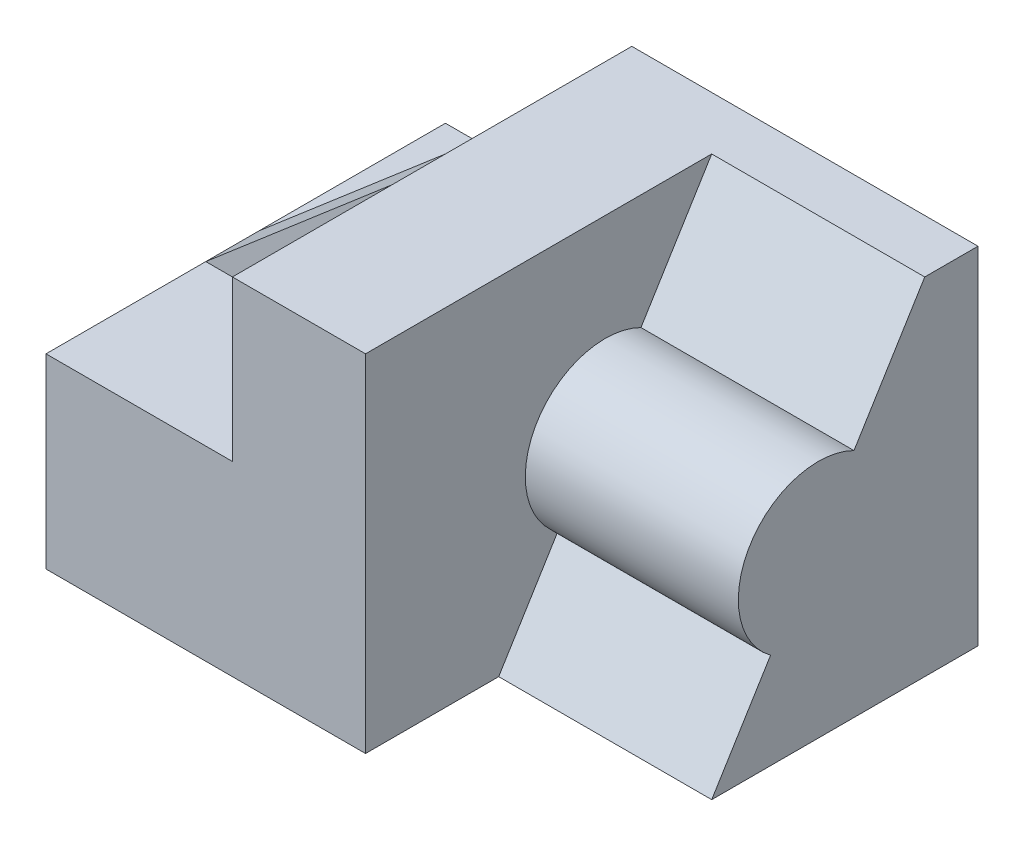
from build123d import *

# Parameters (mm, degrees)
RESSALTO_EXTRUS_O1_DEPTH = 75
RESSALTO_EXTRUS_O2_DEPTH = 40
ESBO_O4_W                = 10
ESBO_O4_H                = 30
RESSALTO_EXTRUS_O3_DEPTH = 35
CORTE_EXTRUS_O1_REACH    = 101.247


with BuildPart() as part:
    # Esboço2 → Ressalto-extrusão1 (new body)
    with BuildSketch(Plane.XY):
        Polygon((-60, 35), (-60, 0), (0, 0), (0, 65), (-25, 65), (-25, 35), align=None)
    extrude(amount=-RESSALTO_EXTRUS_O1_DEPTH)

    # Esboço3 → Ressalto-extrusão2 (add)
    with BuildSketch(Plane(origin=(0, 0, 0), x_dir=(0, 0, -1), z_dir=(1, 0, 0))):
        with BuildLine():
            Line((65, 65), (51.71553286, 43.412740898))
            ThreePointArc((51.71553286, 43.412740898), (32.225125249, 37.861461385), (36.052707483, 17.96064966))
            Line((36.052707483, 17.96064966), (25, 0))
            Line((25, 0), (75, 0))
            Line((75, 0), (75, 65))
            Line((75, 65), (65, 65))
        make_face()
    extrude(amount=RESSALTO_EXTRUS_O2_DEPTH)

    # Esboço4 → Ressalto-extrusão3 (add)
    with BuildSketch(Plane.ZY.offset(25)):
        with Locations((-35, 50)):
            Rectangle(ESBO_O4_W, ESBO_O4_H)
    extrude(amount=RESSALTO_EXTRUS_O3_DEPTH)

    # Esboço6 → Corte-extrusão1 (cut, up to next)
    with BuildSketch(Plane.XY.offset(-30), mode=Mode.PRIVATE) as corte_extrus_o1_sk1:
        Polygon((-25, 65), (-60, 35), (-60, 65), align=None)
    corte_extrus_o1_tool1 = extrude(corte_extrus_o1_sk1.sketch, amount=-CORTE_EXTRUS_O1_REACH, mode=Mode.PRIVATE) & part.part
    add(corte_extrus_o1_tool1.solids().sort_by_distance((-48.333333, 55, -30))[0], mode=Mode.SUBTRACT)


solid = part.part
